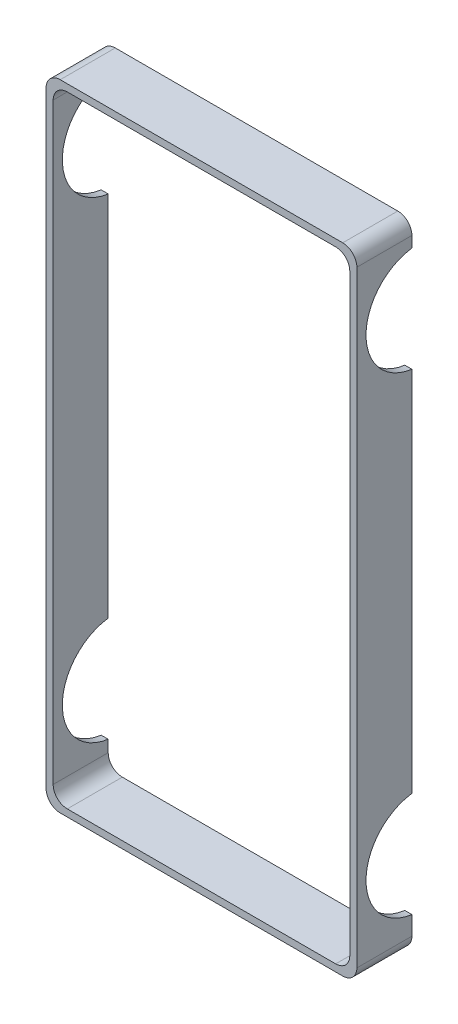
from build123d import *

# Parameters (mm, degrees)
SKETCH_1_W          = 440.4
SKETCH_1_H          = 900
SKETCH_1_W_2        = 420.4
SKETCH_1_H_2        = 880
EXTRUDE_1_DEPTH     = 78
FILLET_1_R          = 20
FILLET_2_R          = 20
CUT_EXTRUDE_1_DEPTH = 730
CUT_EXTRUDE_2_DEPTH = 730


with BuildPart() as part:
    # 草图1 → 凸台-拉伸1 (new body)
    with BuildSketch(Plane.XY):
        with Locations((-39.8, 0)):
            Rectangle(SKETCH_1_W, SKETCH_1_H)
        with Locations((-39.8, 0)):
            Rectangle(SKETCH_1_W_2, SKETCH_1_H_2, mode=Mode.SUBTRACT)
    extrude(amount=EXTRUDE_1_DEPTH)

    # 圆角1
    fillet_1_edges = [part.edges().sort_by_distance(p)[0] for p in [
        (180.4, -450, 39),
        (-260, -450, 39),
        (-260, 450, 39),
        (180.4, 450, 39),
    ]]
    fillet(fillet_1_edges, radius=FILLET_1_R)

    # 圆角2
    fillet_2_edges = [part.edges().sort_by_distance(p)[0] for p in [
        (170.4, -440, 39),
        (170.4, 440, 39),
        (-250, 440, 39),
        (-250, -440, 39),
    ]]
    fillet(fillet_2_edges, radius=FILLET_2_R)

    # 草图2 → 切除-拉伸1 (cut)
    with BuildSketch(Plane(origin=(180.4, 0, 0), x_dir=(0, 0, -1), z_dir=(1, 0, 0))):
        with BuildLine():
            Line((0, 265.819656263), (0, 414.480343737))
            ThreePointArc((0, 414.480343737), (-65, 340.15), (0, 265.819656263))
        make_face()
    extrude(amount=-CUT_EXTRUDE_1_DEPTH, mode=Mode.SUBTRACT)

    # 草图3 → 切除-拉伸2 (cut)
    with BuildSketch(Plane(origin=(180.4, 0, 0), x_dir=(0, 0, -1), z_dir=(1, 0, 0))):
        with BuildLine():
            Line((0, -403.470343737), (0, -254.809656263))
            ThreePointArc((0, -254.809656263), (-65, -329.14), (0, -403.470343737))
        make_face()
    extrude(amount=-CUT_EXTRUDE_2_DEPTH, mode=Mode.SUBTRACT)


solid = part.part
